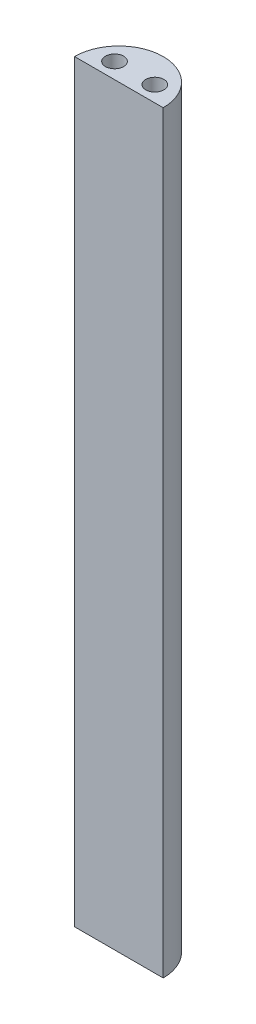
from build123d import *

# Parameters (mm, degrees)
BOSS_EXTRUDE1_DEPTH = 431.8
SKETCH2_R           = 5.207
CUT_EXTRUDE1_DEPTH  = 25.4


with BuildPart() as part:
    # Sketch1 → Boss-Extrude1 (new body)
    with BuildSketch(Plane(origin=(0, 0, 0), x_dir=(1, 0, 0), z_dir=(0, 1, 0))):
        with BuildLine():
            Line((-25.4, 0), (25.4, 0))
            ThreePointArc((25.4, 0), (0, 25.4), (-25.4, 0))
        make_face()
    extrude(amount=BOSS_EXTRUDE1_DEPTH)

    # Sketch2 → Cut-Extrude1 (cut)
    with BuildSketch(Plane(origin=(0, 431.8, 0), x_dir=(1, 0, 0), z_dir=(0, 1, 0))):
        with Locations(Location((-11.54495024, 9.057446198, 0), (0, 0, 270))):
            Circle(SKETCH2_R)
        with Locations(Location((11.54495024, 9.057446198, 0), (0, 0, 270))):
            Circle(SKETCH2_R)
    extrude(amount=-CUT_EXTRUDE1_DEPTH, mode=Mode.SUBTRACT)


solid = part.part
